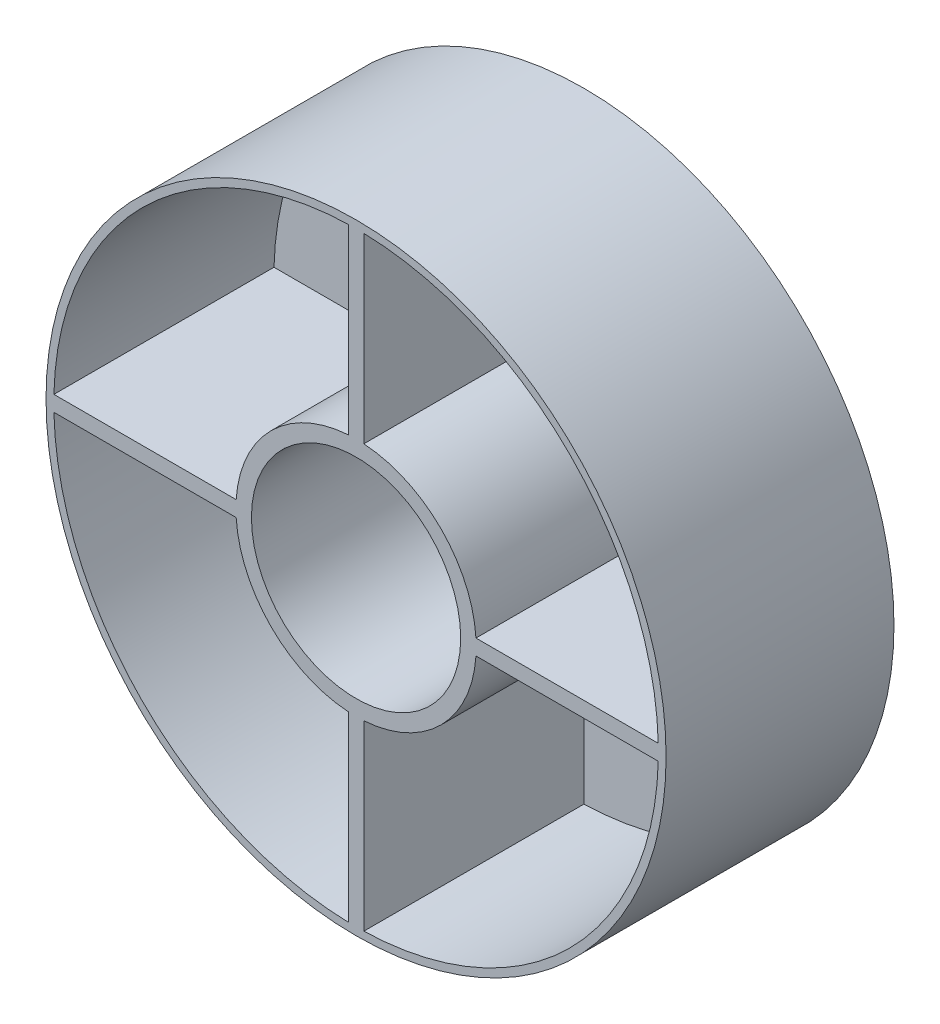
from build123d import *

# Parameters (mm, degrees)
SKETCH1_R                               = 67.5
SKETCH1_R_2                             = 25
BOSS_EXTRUDE1_DEPTH                     = 5
SKETCH1_R_3                             = 195
SKETCH1_R_4                             = 77.5
BOSS_EXTRUDE1_2_DEPTH                   = 5
SKETCH1_4_R                             = 200
SKETCH1_4_R_2                           = 195
BOSS_EXTRUDE2_DEPTH                     = 147
SKETCH1_5_R                             = 77.5
SKETCH1_5_R_2                           = 67.5
BOSS_EXTRUDE3_DEPTH                     = 147
SKETCH1_6_R                             = 25
BOSS_EXTRUDE4_DEPTH                     = 25
BOSS_EXTRUDE5_DEPTH                     = 7
CBORE_FOR_M5_HEX_HEAD_BOLT1_D           = 5.8
CBORE_FOR_M5_HEX_HEAD_BOLT1_CBORE_D     = 12.238
CBORE_FOR_M5_HEX_HEAD_BOLT1_CBORE_DEPTH = 3.5
RIB1_REACH                              = 320.762
SKETCH4_WALLS_W                         = 10
SKETCH4_WALLS_H                         = 759.430387561
SKETCH4_WALLS_H_2                       = 759.674772851
SKETCH4_WALLS_W_2                       = 760.012833466
SKETCH4_WALLS_H_3                       = 10
SKETCH4_WALLS_W_3                       = 759.068922963
SKETCH5_R                               = 70
SKETCH5_R_2                             = 57.5
BOSS_EXTRUDE6_DEPTH                     = 29


with BuildPart() as part:
    # Sketch1 → Boss-Extrude1 (new body)
    with BuildSketch(Plane.XY):
        Circle(SKETCH1_R)
        Circle(SKETCH1_R_2, mode=Mode.SUBTRACT)
    extrude(amount=BOSS_EXTRUDE1_DEPTH)



with BuildPart() as body_2:
    # Sketch1 → Boss-Extrude1 2 (new body)
    with BuildSketch(Plane.XY):
        Circle(SKETCH1_R_3)
        Circle(SKETCH1_R_4, mode=Mode.SUBTRACT)
    extrude(amount=BOSS_EXTRUDE1_2_DEPTH)

    # Sketch1<4> → Boss-Extrude2 (add)
    with BuildSketch(Plane.XY):
        Circle(SKETCH1_4_R)
        Circle(SKETCH1_4_R_2, mode=Mode.SUBTRACT)
    extrude(amount=BOSS_EXTRUDE2_DEPTH)


with BuildPart() as part_1:
    add(part.part)

    add(body_2.part)  # Boss-Extrude3 merges body 2
    # Sketch1<5> → Boss-Extrude3 (add)
    with BuildSketch(Plane.XY):
        Circle(SKETCH1_5_R)
        Circle(SKETCH1_5_R_2, mode=Mode.SUBTRACT)
    extrude(amount=BOSS_EXTRUDE3_DEPTH)

    # Sketch1<6> → Boss-Extrude4 (add)
    with BuildSketch(Plane.XY):
        Circle(SKETCH1_6_R)
        with BuildLine():
            Line((-1.5, 11), (1.5, 11))
            ThreePointArc((1.5, 11), (2.207106781, 10.707106781), (2.5, 10))
            Line((2.5, 10), (2.5, 7.599342077))
            ThreePointArc((2.5, 7.599342077), (6.480740698, 4.69041576), (8, 0))
            ThreePointArc((8, 0), (-4.69041576, -6.480740698), (-2.5, 7.599342077))
            Line((-2.5, 7.599342077), (-2.5, 10))
            ThreePointArc((-2.5, 10), (-2.207106781, 10.707106781), (-1.5, 11))
        make_face(mode=Mode.SUBTRACT)
    extrude(amount=BOSS_EXTRUDE4_DEPTH)

    # Sketch1<7> → Boss-Extrude5 (add)
    with BuildSketch(Plane.XY):
        with BuildLine():
            ThreePointArc((2.5, 10), (2.207106781, 10.707106781), (1.5, 11))
            Line((1.5, 11), (-1.5, 11))
            ThreePointArc((-1.5, 11), (-2.207106781, 10.707106781), (-2.5, 10))
            Line((-2.5, 10), (-2.5, 7.599342077))
            ThreePointArc((-2.5, 7.599342077), (0, -8), (2.5, 7.599342077))
            Line((2.5, 7.599342077), (2.5, 10))
        make_face()
    extrude(amount=BOSS_EXTRUDE5_DEPTH)

    # CBORE for M5 Hex Head Bolt1 (through all)
    with Locations(Plane(origin=(0, 0, 0), x_dir=(-1, 0, 0), z_dir=(0, 0, -1))):
        with Locations((0, 0)):
            CounterBoreHole(CBORE_FOR_M5_HEX_HEAD_BOLT1_D / 2, CBORE_FOR_M5_HEX_HEAD_BOLT1_CBORE_D / 2, CBORE_FOR_M5_HEX_HEAD_BOLT1_CBORE_DEPTH)

    # Sketch4 walls → Rib1 (add, up to next)
    with BuildSketch(Plane.XY.offset(147), mode=Mode.PRIVATE) as rib1_sk1:
        with Locations((0, 137.453527328)):
            Rectangle(SKETCH4_WALLS_W, SKETCH4_WALLS_H)
    rib1_tool1 = extrude(rib1_sk1.sketch, amount=-RIB1_REACH, mode=Mode.PRIVATE) - part_1.part
    # Sketch4 walls → Rib1 (add, up to next)
    with BuildSketch(Plane.XY.offset(147), mode=Mode.PRIVATE) as rib1_sk2:
        with Locations((0, -137.575719973)):
            Rectangle(SKETCH4_WALLS_W, SKETCH4_WALLS_H_2)
    rib1_tool2 = extrude(rib1_sk2.sketch, amount=-RIB1_REACH, mode=Mode.PRIVATE) - part_1.part
    # Sketch4 walls → Rib1 (add, up to next)
    with BuildSketch(Plane.XY.offset(147), mode=Mode.PRIVATE) as rib1_sk3:
        with Locations((137.74475028, 0)):
            Rectangle(SKETCH4_WALLS_W_2, SKETCH4_WALLS_H_3)
    rib1_tool3 = extrude(rib1_sk3.sketch, amount=-RIB1_REACH, mode=Mode.PRIVATE) - part_1.part
    # Sketch4 walls → Rib1 (add, up to next)
    with BuildSketch(Plane.XY.offset(147), mode=Mode.PRIVATE) as rib1_sk4:
        with Locations((-137.272795029, 0)):
            Rectangle(SKETCH4_WALLS_W_3, SKETCH4_WALLS_H_3)
    rib1_tool4 = extrude(rib1_sk4.sketch, amount=-RIB1_REACH, mode=Mode.PRIVATE) - part_1.part
    add(rib1_tool1.solids().sort_by_distance((0, 137.453527328, 147))[0])
    add(rib1_tool2.solids().sort_by_distance((0, -137.575719973, 147))[0])
    add(rib1_tool3.solids().sort_by_distance((137.74475028, 0, 147))[0])
    add(rib1_tool4.solids().sort_by_distance((-137.272795028, 0, 147))[0])

    # Sketch5 → Boss-Extrude6 (add)
    with BuildSketch(Plane.XY.offset(5)):
        Circle(SKETCH5_R)
        Circle(SKETCH5_R_2, mode=Mode.SUBTRACT)
    extrude(amount=BOSS_EXTRUDE6_DEPTH)


solid = part_1.part
